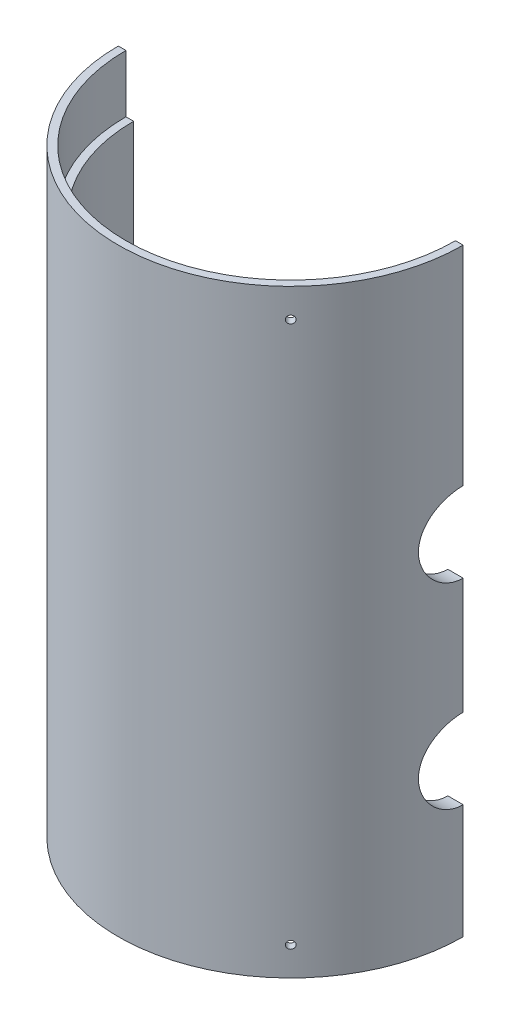
from build123d import *

# Parameters (mm, degrees)
REVOLVE1_ANGLE     = 180
SKETCH2_R          = 10.45
CUT_EXTRUDE1_DEPTH = 169.759266412
SKETCH3_R          = 1
CUT_EXTRUDE2_DEPTH = 169.759266558
CIRPATTERN1_COUNT  = 4


with BuildPart() as part:
    # Sketch1 → Revolve1 (revolve)
    with BuildSketch(Plane.XY):
        Polygon((-45, 0), (-45, 156.3), (-43, 156.3), (-43, 141.3), (-41, 141.3), (-41, 15), (-43, 15), (-43, 0), align=None)
    revolve(axis=Axis((0, 0, 0), (0, 1, 0)), revolution_arc=REVOLVE1_ANGLE)

    # Sketch2 → Cut-Extrude1 (cut, through all)
    with BuildSketch(Plane(origin=(0, 0, 0), x_dir=(0, 0, -1), z_dir=(1, 0, 0))):
        with Locations((0, 40.3)):
            Circle(SKETCH2_R)
        with Locations((0, 91.5)):
            Circle(SKETCH2_R)
    extrude(amount=CUT_EXTRUDE1_DEPTH, mode=Mode.SUBTRACT)

    # Sketch3 → Cut-Extrude2 (cut, through all)
    with BuildSketch(Plane(origin=(0, 0, 0), x_dir=(0, 1, 0), z_dir=(0.7071067811865464, 0, -0.7071067811865488))):
        with Locations(Location((7.5, 0, 0), (0, 0, 270))):
            Circle(SKETCH3_R)
        with Locations(Location((148.8, 0, 0), (0, 0, 270))):
            Circle(SKETCH3_R)
    cut_extrude2 = extrude(amount=-CUT_EXTRUDE2_DEPTH, mode=Mode.SUBTRACT)

    # CirPattern1: Cut-Extrude2 ×4 about axis
    cirpattern1_axis = Axis((0, 0, 0), (0, -1, 0))
    for i in range(1, CIRPATTERN1_COUNT):
        add(cut_extrude2.rotate(cirpattern1_axis, i * 360 / CIRPATTERN1_COUNT), mode=Mode.SUBTRACT)


solid = part.part
